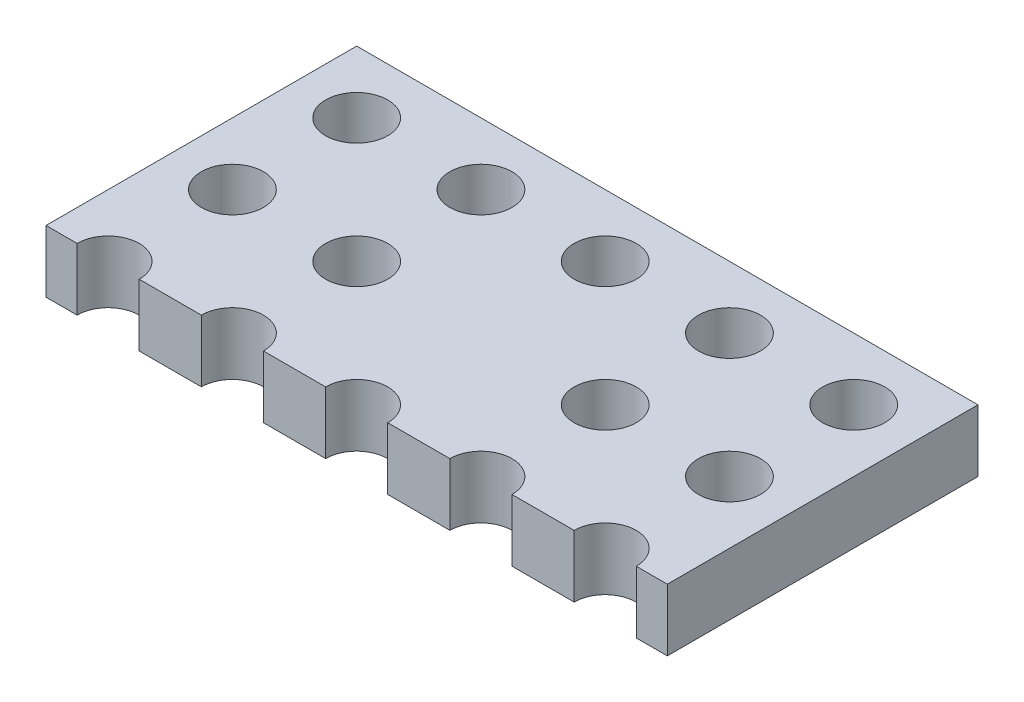
from build123d import *

# Parameters (mm, degrees)
SKETCH1_W            = 100
SKETCH1_H            = 50
BOSS_EXTRUDE1_DEPTH  = 10
SKETCH2_R            = 5
CUT_EXTRUDE1_DEPTH   = 10
LPATTERN1_COUNT      = 5
LPATTERN1_PITCH      = 20
LPATTERN1_COUNT_DIR2 = 3
LPATTERN1_PITCH_DIR2 = 20


with BuildPart() as part:
    # Sketch1 → Boss-Extrude1 (new body)
    with BuildSketch(Plane(origin=(0, 0, 0), x_dir=(1, 0, 0), z_dir=(0, 1, 0))):
        Rectangle(SKETCH1_W, SKETCH1_H)
    extrude(amount=BOSS_EXTRUDE1_DEPTH)

    # Sketch2 → Cut-Extrude1 (cut)
    with BuildSketch(Plane(origin=(0, 10, 0), x_dir=(1, 0, 0), z_dir=(0, 1, 0))):
        with Locations(Location((-40, 15, 0), (0, 0, 270))):
            Circle(SKETCH2_R)
    cut_extrude1 = extrude(amount=-CUT_EXTRUDE1_DEPTH, mode=Mode.SUBTRACT)

    # LPattern1: Cut-Extrude1 5 × 3, 1 skipped
    with Locations(*[(i * LPATTERN1_PITCH, 0, j * LPATTERN1_PITCH_DIR2) for i in range(LPATTERN1_COUNT) for j in range(LPATTERN1_COUNT_DIR2) if (i, j) not in ((0, 0), (2, 1))]):
        add(cut_extrude1, mode=Mode.SUBTRACT)


solid = part.part
